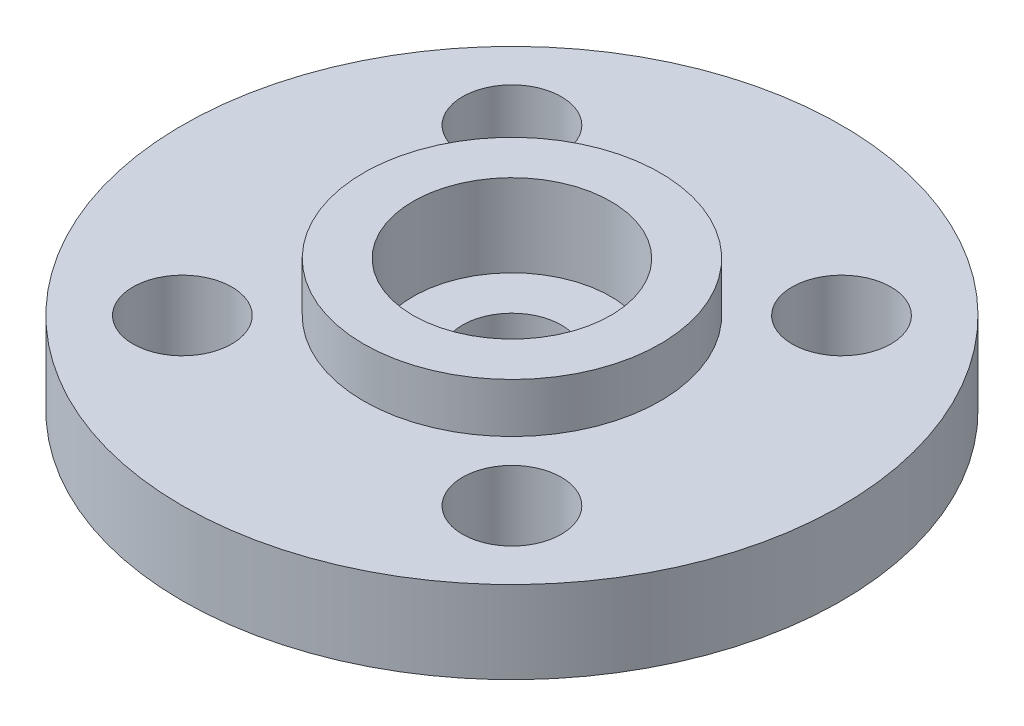
from build123d import *

# Parameters (mm, degrees)
SKETCH_1_R          = 10
SKETCH_1_R_2        = 1.5
EXTRUDE_2_DEPTH     = 2.5
SKETCH_2_R          = 3
CUT_EXTRUDE_1_DEPTH = 1
SKETCH_3_R          = 1.5
CUT_EXTRUDE_3_DEPTH = 15.221462653
EXTRUDE_START       = 1.5
SKETCH_4_R          = 4.5
SKETCH_4_R_2        = 3
EXTRUDE_3_DEPTH     = 1.5


with BuildPart() as part:
    # 草图1 → 凸台-拉伸2 (new body)
    with BuildSketch(Plane(origin=(0, 0, 0), x_dir=(1, 0, 0), z_dir=(0, 1, 0))):
        with Locations(Location((0, 0, 0), (0, 0, 270))):
            Circle(SKETCH_1_R)
        with Locations(Location((-5, 5, 0), (0, 0, 270))):
            Circle(SKETCH_1_R_2, mode=Mode.SUBTRACT)
        with Locations(Location((5, 5, 0), (0, 0, 270))):
            Circle(SKETCH_1_R_2, mode=Mode.SUBTRACT)
        with Locations(Location((5, -5, 0), (0, 0, 270))):
            Circle(SKETCH_1_R_2, mode=Mode.SUBTRACT)
        with Locations(Location((-5, -5, 0), (0, 0, 270))):
            Circle(SKETCH_1_R_2, mode=Mode.SUBTRACT)
    extrude(amount=EXTRUDE_2_DEPTH)

    # 草图2 → 切除-拉伸1 (cut)
    with BuildSketch(Plane(origin=(0, 2.5, 0), x_dir=(1, 0, 0), z_dir=(0, 1, 0))):
        with Locations(Location((0, 0, 0), (0, 0, 270))):
            Circle(SKETCH_2_R)
    extrude(amount=-CUT_EXTRUDE_1_DEPTH, mode=Mode.SUBTRACT)

    # 草图3 → 切除-拉伸3 (cut, through all)
    with BuildSketch(Plane(origin=(0, 1.5, 0), x_dir=(1, 0, 0), z_dir=(0, 1, 0))):
        with Locations(Location((0, 0, 0), (0, 0, 270))):
            Circle(SKETCH_3_R)
    extrude(amount=-CUT_EXTRUDE_3_DEPTH, mode=Mode.SUBTRACT)

    # 草图4 → 凸台-拉伸3 (add)
    with BuildSketch(Plane(origin=(0, 2.5, 0), x_dir=(1, 0, 0), z_dir=(0, 1, 0)).offset(EXTRUDE_START)):
        with Locations(Location((0, 0, 0), (0, 0, 270))):
            Circle(SKETCH_4_R)
        with Locations(Location((0, 0, 0), (0, 0, 270))):
            Circle(SKETCH_4_R_2, mode=Mode.SUBTRACT)
    extrude(amount=-EXTRUDE_3_DEPTH)


solid = part.part
